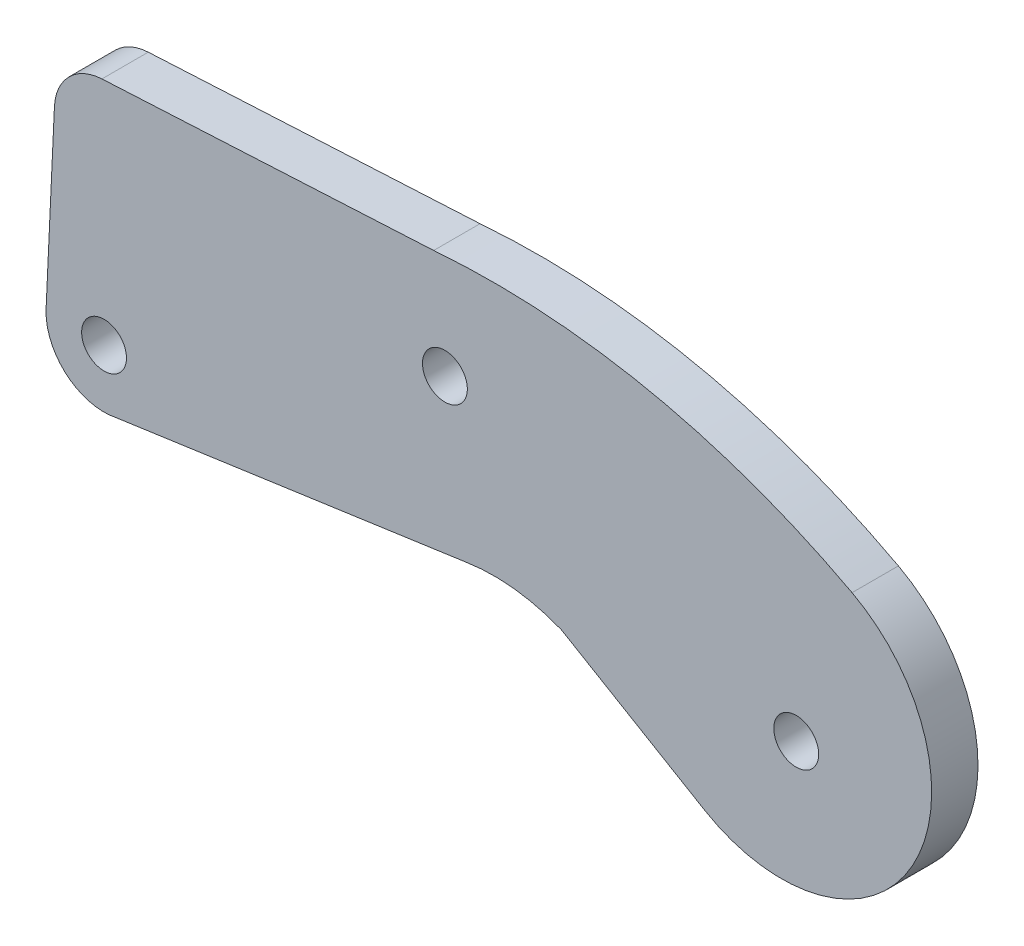
from build123d import *

# Parameters (mm, degrees)
SKETCH1_R           = 3
BOSS_EXTRUDE1_DEPTH = 6.2


with BuildPart() as part:
    # Sketch1 → Boss-Extrude1 (new body)
    with BuildSketch(Plane.XY):
        with BuildLine():
            Line((-44, -26.8), (2.7, -20.15))
            ThreePointArc((2.7, -20.15), (9.249876076, -19.98611928), (15.6, -21.599705241))
            Line((15.6, -21.599705241), (34.768435899, -32.920104396))
            ThreePointArc((34.768435899, -32.920104396), (62.542861937, -25.448265408), (54.469609674, 2.157344845))
            ThreePointArc((54.469609674, 2.157344845), (27.320189876, 11.997539893), (-1.5, 13.818827736))
            Line((-1.5, 13.818827736), (-45.886645473, 11.5))
            ThreePointArc((-45.886645473, 11.5), (-50.294249478, 9.530490598), (-52.238519213, 5.111694886))
            Line((-52.238519213, 5.111694886), (-53.366350091, -19.138305114))
            ThreePointArc((-53.366350091, -19.138305114), (-50.517454676, -25.21154219), (-44, -26.8))
        make_face()
        with Locations(Location((47, -18.8, 0), (0, 0, 180))):
            Circle(SKETCH1_R, mode=Mode.SUBTRACT)
        with Locations(Location((-45.6, -19.2, 0), (0, 0, 180))):
            Circle(SKETCH1_R, mode=Mode.SUBTRACT)
        with Locations(Location((0, 0, 0), (0, 0, 180))):
            Circle(SKETCH1_R, mode=Mode.SUBTRACT)
    extrude(amount=BOSS_EXTRUDE1_DEPTH)


solid = part.part
